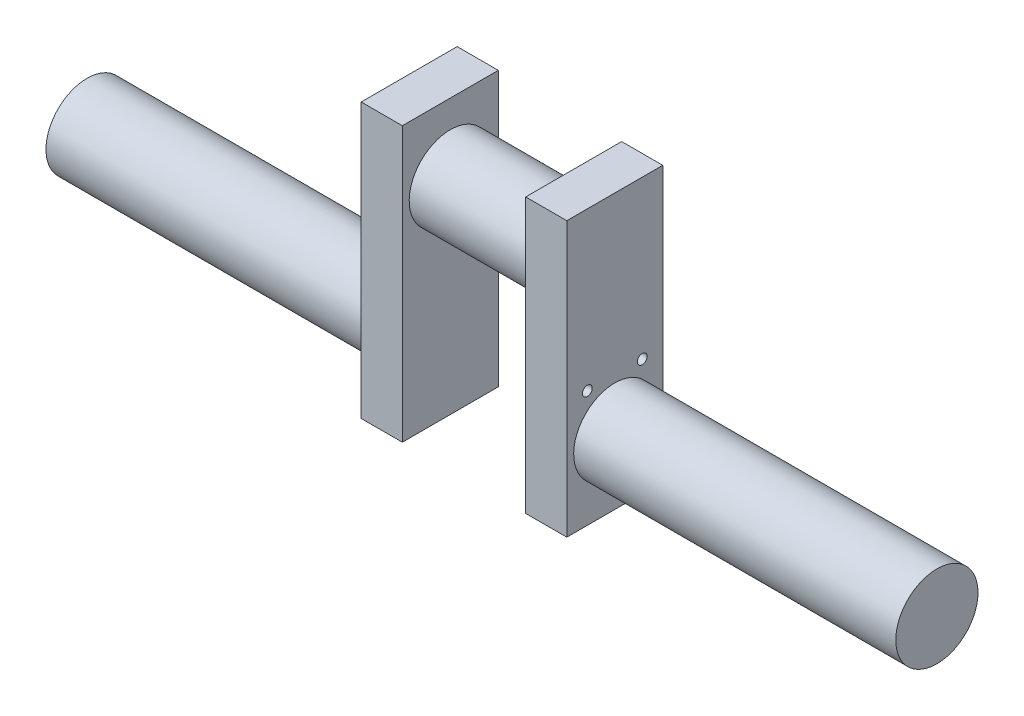
from build123d import *

# Parameters (mm, degrees)
SKETCH2_W                       = 9.525
SKETCH2_H                       = 63.5
BOSS_EXTRUDE1_DEPTH             = 22.225
BOSS_EXTRUDE1_2_DEPTH           = 22.225
BOSS_EXTRUDE3_REACH             = 69.295
SKETCH3_R                       = 9.525
SKETCH4_R                       = 9.525
BOSS_EXTRUDE4_DEPTH             = 74.6125
F_43_0_089_DIAMETER_HOLE1_D     = 2.2606
F_43_0_089_DIAMETER_HOLE1_DEPTH = 6.35
F_43_0_089_DIAMETER_HOLE1_TIP   = 0.679152758


with BuildPart() as part:
    # Sketch2 → Boss-Extrude1 (new body)
    with BuildSketch(Plane.XY):
        with Locations((-19.05, 19.074189237)):
            Rectangle(SKETCH2_W, SKETCH2_H)
    extrude(amount=BOSS_EXTRUDE1_DEPTH)


with BuildPart() as body_2:
    # Sketch2 → Boss-Extrude1 2 (new body)
    with BuildSketch(Plane.XY):
        with Locations((19.05, 19.074189237)):
            Rectangle(SKETCH2_W, SKETCH2_H)
    extrude(amount=BOSS_EXTRUDE1_2_DEPTH)

    # Sketch3 → Boss-Extrude3 (add, up to next)
    with BuildSketch(Plane(origin=(-14.2875, 0, 0), x_dir=(0, 0, -1), z_dir=(1, 0, 0)), mode=Mode.PRIVATE) as boss_extrude3_sk1:
        with Locations(Location((-11.1125, 34.949189237, 0), (0, 0, 270))):
            Circle(SKETCH3_R)
    boss_extrude3_tool1 = extrude(boss_extrude3_sk1.sketch, amount=BOSS_EXTRUDE3_REACH, mode=Mode.PRIVATE) - body_2.part

    add(part.part)  # Boss-Extrude3 merges part
    add(boss_extrude3_tool1.solids().sort_by_distance((-14.2875, 34.949189, 11.1125))[0])

    # Sketch4 → Boss-Extrude4 (add)
    with BuildSketch(Plane(origin=(23.8125, 0, 0), x_dir=(0, 0, -1), z_dir=(1, 0, 0))):
        with Locations(Location((-11.1125, 3.199189237, 0), (0, 0, 270))):
            Circle(SKETCH4_R)
    boss_extrude4 = extrude(amount=BOSS_EXTRUDE4_DEPTH)

    # Mirror1: Boss-Extrude4 across plane
    add(boss_extrude4.mirror(Plane(origin=(0, 0, 0), x_dir=(0, 0, 1), z_dir=(1, 0, 0))))

    # #43 (0.089) Diameter Hole1
    with Locations(Plane(origin=(23.8125, 0, 0), x_dir=(0, 0, -1), z_dir=(1, 0, 0))):
        with Locations((-17.4625, 14.311689237), (-4.7625, 14.311689237)):
            Hole(F_43_0_089_DIAMETER_HOLE1_D / 2, depth=F_43_0_089_DIAMETER_HOLE1_DEPTH)
            with Locations((0, 0, -(F_43_0_089_DIAMETER_HOLE1_DEPTH + F_43_0_089_DIAMETER_HOLE1_TIP / 2))):  # 118° drill point
                Cone(0, F_43_0_089_DIAMETER_HOLE1_D / 2, F_43_0_089_DIAMETER_HOLE1_TIP, mode=Mode.SUBTRACT)


solid = body_2.part
